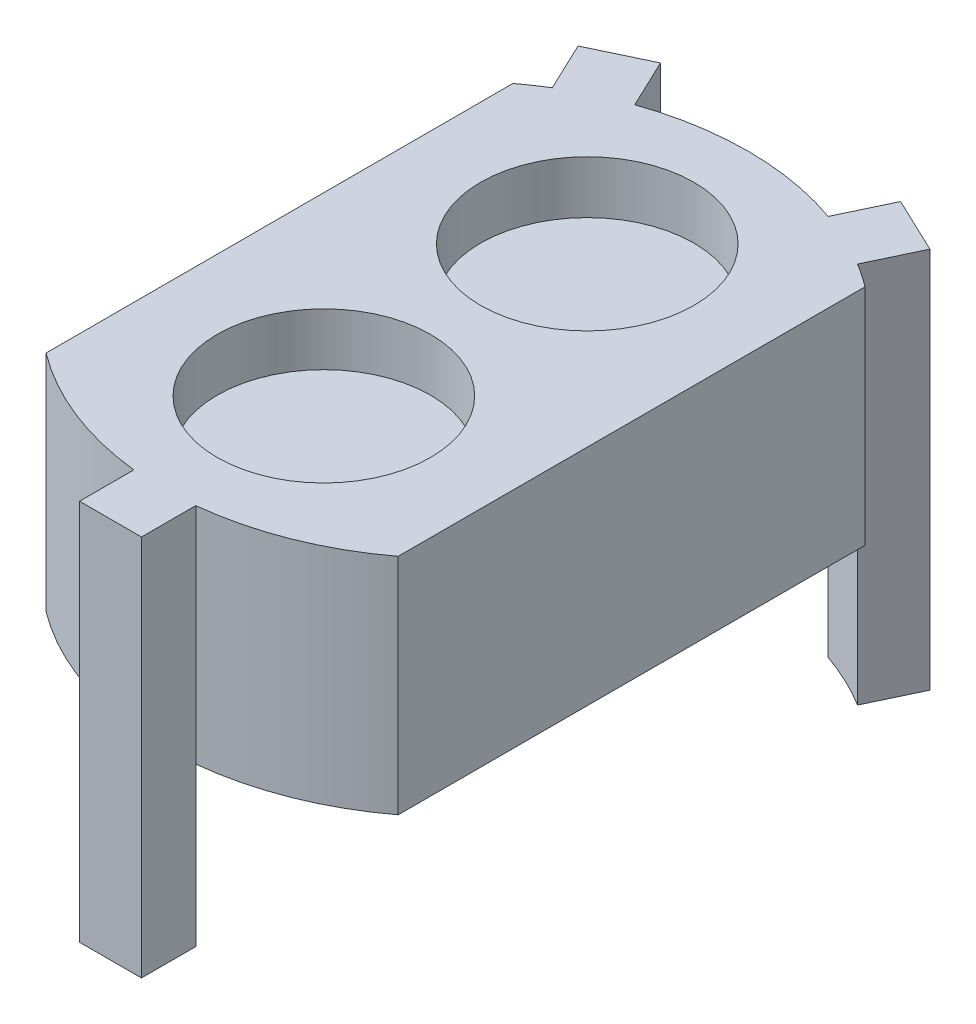
from build123d import *

# Parameters (mm, degrees)
BOSS_EXTRUDE2_DEPTH = 14.5
SKETCH3_R           = 11.1
CUT_EXTRUDE1_DEPTH  = 6
SKETCH5_R           = 4.05
CUT_EXTRUDE2_DEPTH  = 2
SKETCH6_W           = 4.420864072
SKETCH6_H           = 22.2
CUT_EXTRUDE4_DEPTH  = 23.47376248


with BuildPart() as part:
    # Sketch2 → Boss-Extrude2 (new body)
    with BuildSketch(Plane(origin=(0, 0, 0), x_dir=(1, 0, 0), z_dir=(0, 1, 0))):
        with BuildLine():
            Line((-5.794734139, 9.467367969), (-6.679135928, 11.330479613))
            Line((-6.679135928, 11.330479613), (-4.556179387, 12.33822736))
            Line((-4.556179387, 12.33822736), (-3.671777598, 10.475115716))
            ThreePointArc((-3.671777598, 10.475115716), (0, 11.1), (3.671777598, 10.475115716))
            Line((3.671777598, 10.475115716), (4.556179387, 12.33822736))
            Line((4.556179387, 12.33822736), (6.679135928, 11.330479613))
            Line((6.679135928, 11.330479613), (5.794734139, 9.467367969))
            ThreePointArc((5.794734139, 9.467367969), (10.828577002, -2.439655736), (1.175, -11.037634484))
            Line((1.175, -11.037634484), (1.175, -13.1))
            Line((1.175, -13.1), (-1.175, -13.1))
            Line((-1.175, -13.1), (-1.175, -11.037634484))
            ThreePointArc((-1.175, -11.037634484), (-10.828577002, -2.439655736), (-5.794734139, 9.467367969))
        make_face()
    extrude(amount=BOSS_EXTRUDE2_DEPTH)

    # Sketch3 → Cut-Extrude1 (cut)
    with BuildSketch(Plane.XZ):
        Circle(SKETCH3_R)
    extrude(amount=-CUT_EXTRUDE1_DEPTH, mode=Mode.SUBTRACT)

    # Sketch5 → Cut-Extrude2 (cut)
    with BuildSketch(Plane(origin=(0, 14.5, 0), x_dir=(1, 0, 0), z_dir=(0, 1, 0))):
        with Locations(Location((0, 5, 0), (0, 0, 270))):
            Circle(SKETCH5_R)
        with Locations(Location((0, -5, 0), (0, 0, 270))):
            Circle(SKETCH5_R)
    extrude(amount=-CUT_EXTRUDE2_DEPTH, mode=Mode.SUBTRACT)

    # Sketch6 → Cut-Extrude4 (cut, through all)
    with BuildSketch(Plane(origin=(0, 0, 0), x_dir=(1, 0, 0), z_dir=(0, 1, 0))):
        with Locations((8.894567964, 0)):
            Rectangle(SKETCH6_W, SKETCH6_H)
        with Locations((-8.894567964, 0)):
            Rectangle(SKETCH6_W, SKETCH6_H)
    extrude(amount=CUT_EXTRUDE4_DEPTH, mode=Mode.SUBTRACT)


solid = part.part
